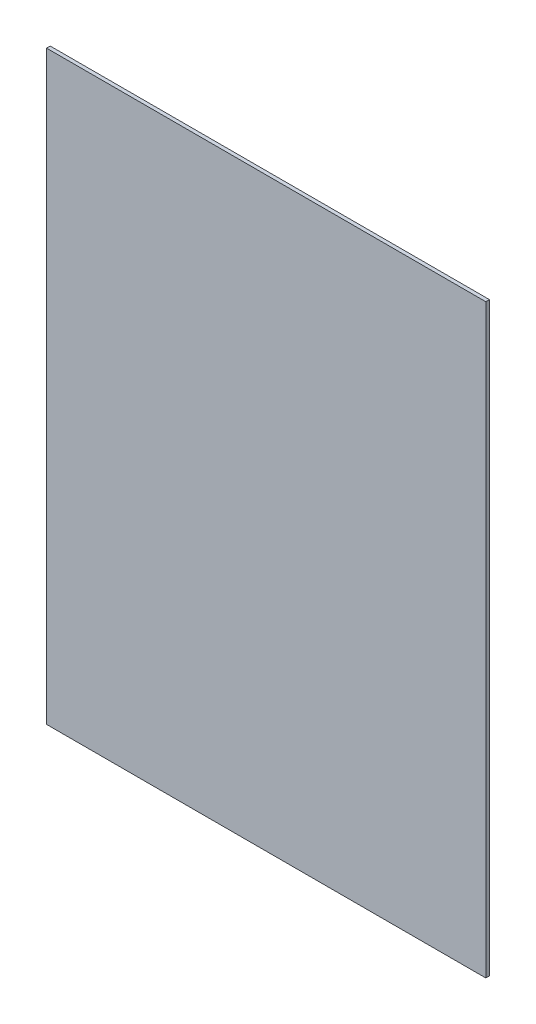
from build123d import *

# Parameters (mm, degrees)
ESQUISSE1_W        = 600
ESQUISSE1_H        = 800
BOSS_EXTRU_1_DEPTH = 5


with BuildPart() as part:
    # Esquisse1 → Boss.-Extru.1 (new body)
    with BuildSketch(Plane.XY):
        Rectangle(ESQUISSE1_W, ESQUISSE1_H)
    extrude(amount=BOSS_EXTRU_1_DEPTH)


solid = part.part
